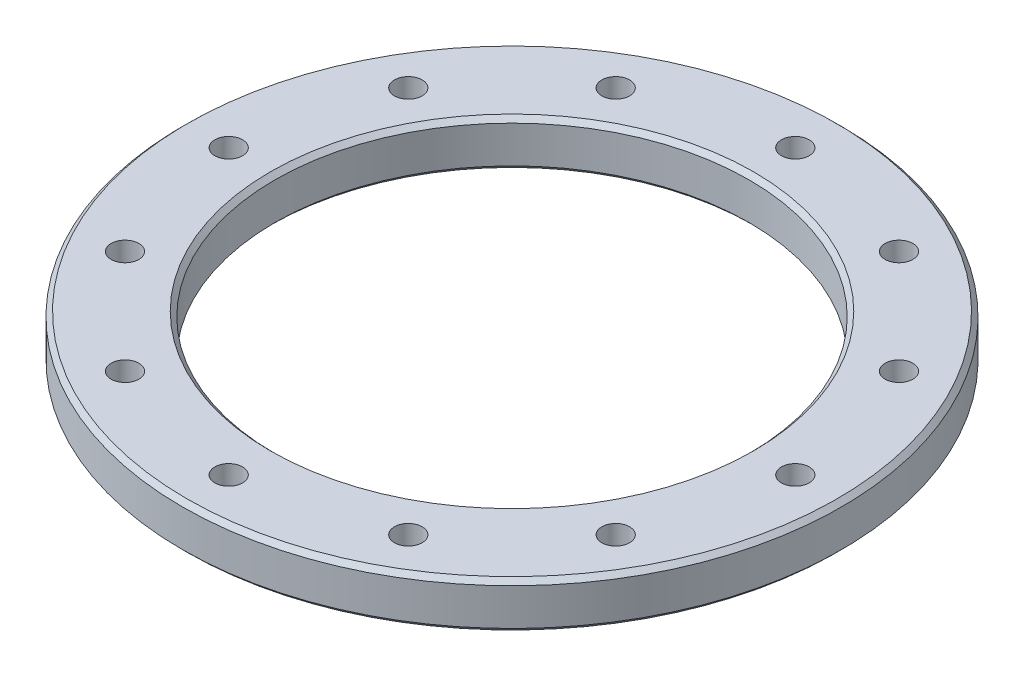
from build123d import *

# Parameters (mm, degrees)
SKETCH3_R           = 35.625
SKETCH3_R_2         = 25.625
BOSS_EXTRUDE1_DEPTH = 5
CUT_EXTRUDE1_REACH  = 52.629
SKETCH4_R           = 1.5
CIRPATTERN1_COUNT   = 12
CHAMFER1_SIZE       = 0.5


with BuildPart() as part:
    # Sketch3 → Boss-Extrude1 (new body)
    with BuildSketch(Plane(origin=(0, 0, 0), x_dir=(1, 0, 0), z_dir=(0, 1, 0))):
        with Locations(Location((0, 0, 0), (0, 0, 270))):
            Circle(SKETCH3_R)
        with Locations(Location((0, 0, 0), (0, 0, 270))):
            Circle(SKETCH3_R_2, mode=Mode.SUBTRACT)
    extrude(amount=BOSS_EXTRUDE1_DEPTH)

    # Sketch4 → Cut-Extrude1 (cut, up to next)
    with BuildSketch(Plane(origin=(0, 5, 0), x_dir=(1, 0, 0), z_dir=(0, 1, 0)), mode=Mode.PRIVATE) as cut_extrude1_sk1:
        with Locations(Location((0, 30.625, 0), (0, 0, 270))):
            Circle(SKETCH4_R)
    cut_extrude1_tool1 = extrude(cut_extrude1_sk1.sketch, amount=-CUT_EXTRUDE1_REACH, mode=Mode.PRIVATE) & part.part
    cut_extrude1 = cut_extrude1_tool1.solids().sort_by_distance((0, 5, -30.625))[0]
    add(cut_extrude1, mode=Mode.SUBTRACT)

    # CirPattern1: Cut-Extrude1 ×12 about axis
    cirpattern1_axis = Axis((0, 0, 0), (0, 1, 0))
    for i in range(1, CIRPATTERN1_COUNT):
        add(cut_extrude1.rotate(cirpattern1_axis, i * 360 / CIRPATTERN1_COUNT), mode=Mode.SUBTRACT)

    # Chamfer1
    chamfer1_edges = [part.edges().sort_by_distance(p)[0] for p in [
        (0, 0, -35.625),
        (0, 5, -35.625),
        (0, 0, -25.625),
        (0, 5, -25.625),
    ]]
    chamfer(chamfer1_edges, length=CHAMFER1_SIZE)


solid = part.part
